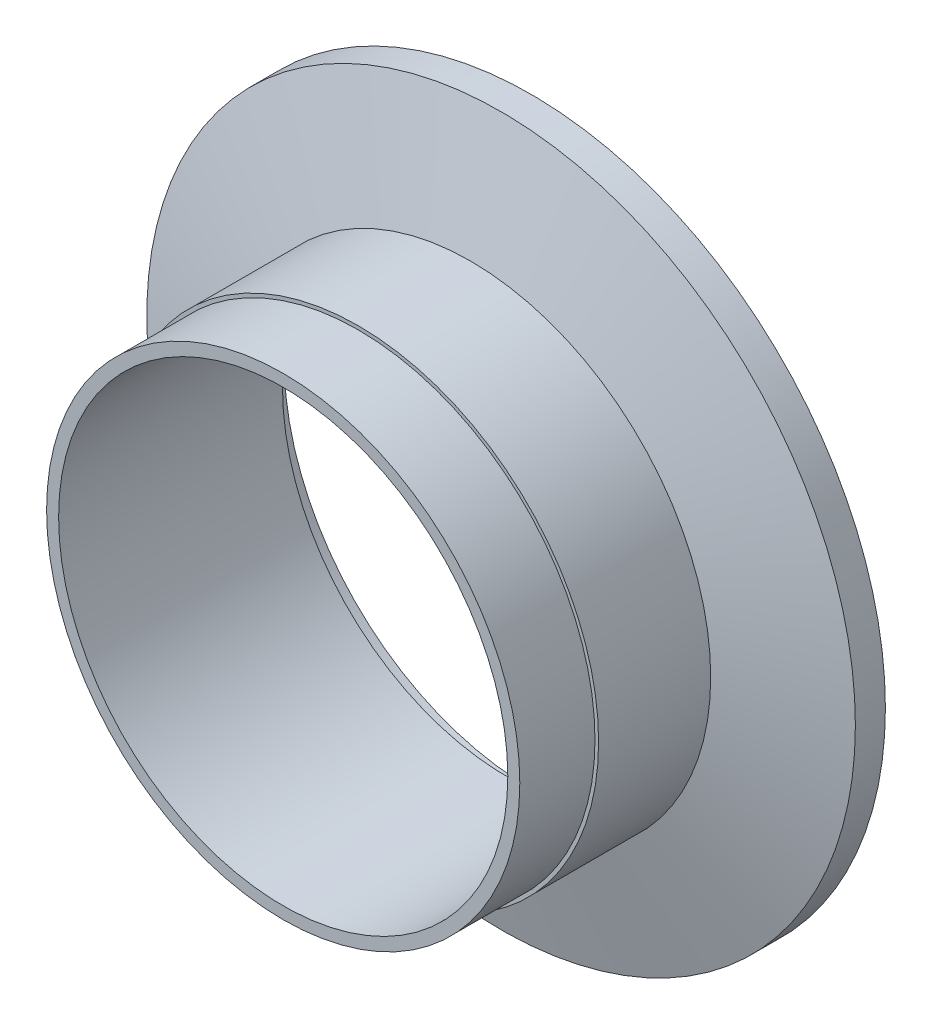
from build123d import *

# Parameters (mm, degrees)
SKETCH2_W = 21.629907471
SKETCH2_H = 12.119969406


with BuildPart() as part:
    # Sketch1 → Revolve1 (revolve)
    with BuildSketch(Plane(origin=(0, 0, 0), x_dir=(0, 0, -1), z_dir=(1, 0, 0)), mode=Mode.PRIVATE) as revolve1_sk:
        Polygon((0, 26.1112), (-2.54, 26.1112), (-2.54, 23.749), (-26.2128, 23.749), (-26.2128, 25.4), (-6.407807007, 25.4), (-3.175, 37.465), (0, 37.465), align=None)
    revolve(revolve1_sk.sketch.rotate(Axis((0, 0, 56.040860285), (0, 0, -1)), 90), axis=Axis((0, 0, 56.040860285), (0, 0, -1)))

    # Sketch2 → Cut-Revolve1 (revolve, cut)
    with BuildSketch(Plane(origin=(0, 0, 0), x_dir=(0, 0, -1), z_dir=(1, 0, 0)), mode=Mode.PRIVATE) as cut_revolve1_sk:
        with Locations((-29.077553736, 31.078984703)):
            Rectangle(SKETCH2_W, SKETCH2_H)
    revolve(cut_revolve1_sk.sketch.rotate(Axis((0, 0, 38.126599349), (0, 0, 1)), 270), axis=Axis((0, 0, 38.126599349), (0, 0, 1)), mode=Mode.SUBTRACT)


solid = part.part
